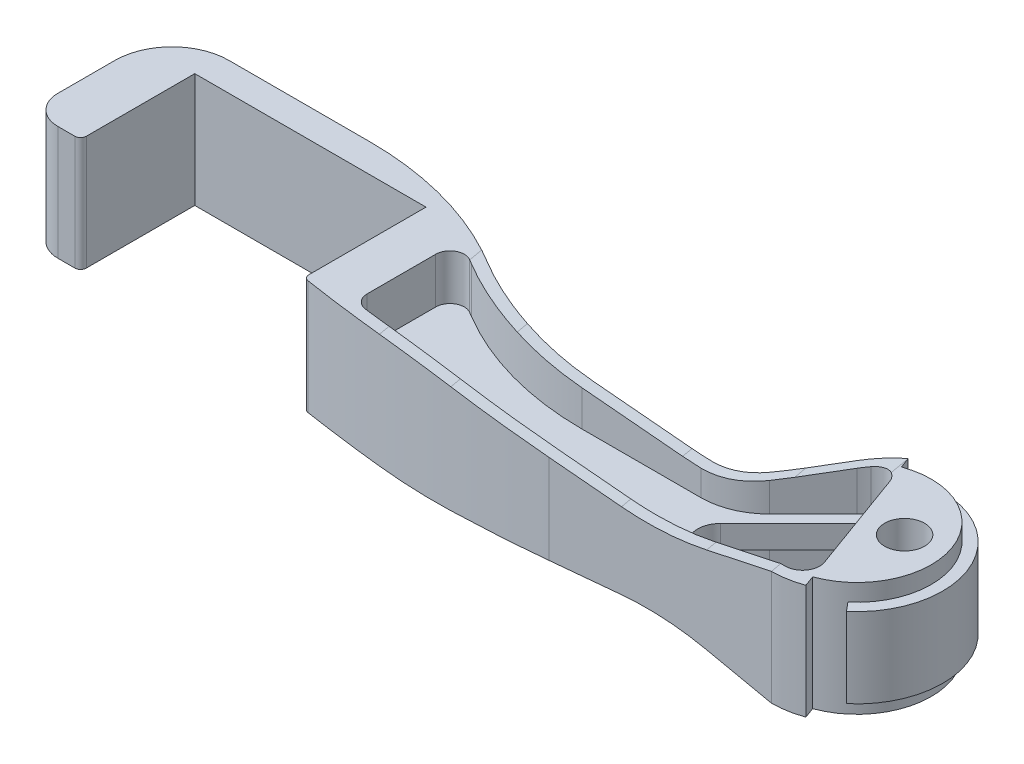
from build123d import *

# Parameters (mm, degrees)
CROQUIS1_R              = 3.5
SALIENTE_EXTRUIR1_DEPTH = 2
CROQUIS2_R              = 3.5
SALIENTE_EXTRUIR2_DEPTH = 10
SALIENTE_EXTRUIR3_DEPTH = 7
CORTAR_EXTRUIR1_DEPTH   = 83.665164829


with BuildPart() as part:
    # Croquis1 → Saliente-Extruir1 (new, symmetric)
    with BuildSketch(Plane(origin=(0, 0, 0), x_dir=(1, 0, 0), z_dir=(0, 1, 0))):
        with BuildLine():
            Line((-65, 15), (-40.296472568, 15))
            ThreePointArc((-40.296472568, 15), (-25.597104262, 12.999326141), (-11.967141117, 7.142857143))
            ThreePointArc((-11.967141117, 7.142857143), (0.423734469, 1.818794417), (13.786796564, 0))
            Line((13.786796564, 0), (34.644660941, 0))
            ThreePointArc((34.644660941, 0), (38.471495264, 0.761204675), (41.715728753, 2.928932188))
            Line((41.715728753, 2.928932188), (49.393398282, 10.606601718))
            ThreePointArc((49.393398282, 10.606601718), (51.940505875, 12.650871687), (54.86969785, 14.095389312))
            Line((54.86969785, 14.095389312), (55.553738137, 12.21600407))
            ThreePointArc((55.553738137, 12.21600407), (57.74257369, 12.802500789), (60, 13))
            Line((60, 13), (60, 15))
            ThreePointArc((60, 15), (74.095389312, 5.13030215), (69.641814145, -11.490666647))
            Line((69.641814145, -11.490666647), (68.356238926, -9.958577761))
            ThreePointArc((68.356238926, -9.958577761), (66.5, -11.258330249), (64.446261863, -12.21600407))
            Line((64.446261863, -12.21600407), (65.13030215, -14.095389312))
            ThreePointArc((65.13030215, -14.095389312), (62.604722665, -14.772116295), (60, -15))
            Line((60, -15), (21, -15))
            ThreePointArc((21, -15), (-1.892838305, -14.125254625), (-24.652173913, -11.506119696))
            ThreePointArc((-24.652173913, -11.506119696), (-25.259003924, -11.168852013), (-25.5, -10.517765963))
            Line((-25.5, -10.517765963), (-25.5, 10))
            Line((-25.5, 10), (-66, 10))
            Line((-66, 10), (-66, -9))
            ThreePointArc((-66, -9), (-66.292893219, -9.707106781), (-67, -10))
            Line((-67, -10), (-70, -10))
            ThreePointArc((-70, -10), (-73.535533906, -8.535533906), (-75, -5))
            Line((-75, -5), (-75, 5))
            ThreePointArc((-75, 5), (-72.071067812, 12.071067812), (-65, 15))
        make_face()
        with Locations(Location((66.108002035, 2.223130932, 0), (0, 0, 270))):
            Circle(CROQUIS1_R, mode=Mode.SUBTRACT)
        with BuildLine():
            Line((57.461693581, 6.97393957), (62.538306419, -6.97393957))
            ThreePointArc((62.538306419, -6.97393957), (62.17668469, -9.720729309), (59.719228557, -11))
            Line((59.719228557, -11), (43.108950141, -11))
            ThreePointArc((43.108950141, -11), (39.413432011, -8.530733729), (40.280523016, -4.171572875))
            Line((40.280523016, -4.171572875), (52.521295375, 8.069199484))
            ThreePointArc((52.521295375, 8.069199484), (55.29193456, 8.876767161), (57.461693581, 6.97393957))
        make_face(mode=Mode.SUBTRACT)
    extrude(amount=SALIENTE_EXTRUIR1_DEPTH, both=True)

    # Croquis2 → Saliente-Extruir2 (add, symmetric)
    with BuildSketch(Plane(origin=(0, 0, 0), x_dir=(1, 0, 0), z_dir=(0, 1, 0))):
        with BuildLine():
            Line((54.86969785, 14.095389312), (55.553738137, 12.21600407))
            ThreePointArc((55.553738137, 12.21600407), (72.21600407, 4.446261863), (64.446261863, -12.21600407))
            Line((64.446261863, -12.21600407), (65.13030215, -14.095389312))
            ThreePointArc((65.13030215, -14.095389312), (62.604722665, -14.772116295), (60, -15))
            Line((60, -15), (21, -15))
            ThreePointArc((21, -15), (-1.892838305, -14.125254625), (-24.652173913, -11.506119696))
            ThreePointArc((-24.652173913, -11.506119696), (-25.259003924, -11.168852013), (-25.5, -10.517765963))
            Line((-25.5, -10.517765963), (-25.5, 10))
            Line((-25.5, 10), (-66, 10))
            Line((-66, 10), (-66, -9))
            ThreePointArc((-66, -9), (-66.292893219, -9.707106781), (-67, -10))
            Line((-67, -10), (-70, -10))
            ThreePointArc((-70, -10), (-73.535533906, -8.535533906), (-75, -5))
            Line((-75, -5), (-75, 5))
            ThreePointArc((-75, 5), (-72.071067812, 12.071067812), (-65, 15))
            Line((-65, 15), (-40.296472568, 15))
            ThreePointArc((-40.296472568, 15), (-25.597104262, 12.999326141), (-11.967141117, 7.142857143))
            ThreePointArc((-11.967141117, 7.142857143), (0.423734469, 1.818794417), (13.786796564, 0))
            Line((13.786796564, 0), (34.644660941, 0))
            ThreePointArc((34.644660941, 0), (38.471495264, 0.761204675), (41.715728753, 2.928932188))
            Line((41.715728753, 2.928932188), (49.393398282, 10.606601718))
            ThreePointArc((49.393398282, 10.606601718), (51.940505875, 12.650871687), (54.86969785, 14.095389312))
        make_face()
        with Locations(Location((66.108002035, 2.223130932, 0), (0, 0, 270))):
            Circle(CROQUIS2_R, mode=Mode.SUBTRACT)
        with BuildLine():
            Line((13.786796564, -2), (34.644660941, -2))
            ThreePointArc((34.644660941, -2), (39.236862129, -1.08655439), (43.129942315, 1.514718626))
            Line((43.129942315, 1.514718626), (50.807611845, 9.192388155))
            ThreePointArc((50.807611845, 9.192388155), (51.432121169, 9.777088132), (52.093735288, 10.319446608))
            ThreePointArc((52.093735288, 10.319446608), (54.758810503, 10.817874623), (56.737335776, 8.964096282))
            Line((56.737335776, 8.964096282), (63.262664224, -8.964096282))
            ThreePointArc((63.262664224, -8.964096282), (62.938611682, -11.65594441), (60.57666227, -12.987203726))
            ThreePointArc((60.57666227, -12.987203726), (60.288402114, -12.996800538), (60, -13))
            Line((60, -13), (21, -13))
            ThreePointArc((21, -13), (2.813818289, -12.444554152), (-15.304568528, -10.780287213))
            ThreePointArc((-15.304568528, -10.780287213), (-16.872354309, -9.955498637), (-17.5, -8.298908965))
            Line((-17.5, -8.298908965), (-17.5, 3.707419))
            ThreePointArc((-17.5, 3.707419), (-16.248849159, 5.87314654), (-13.747699378, 5.871152614))
            ThreePointArc((-13.747699378, 5.871152614), (-13.371589613, 5.651403898), (-12.997298625, 5.428571429))
            ThreePointArc((-12.997298625, 5.428571429), (-0.110788015, -0.108453806), (13.786796564, -2))
        make_face(mode=Mode.SUBTRACT)
    extrude(amount=SALIENTE_EXTRUIR2_DEPTH, both=True)

    # Croquis3 → Saliente-Extruir3 (add, symmetric)
    with BuildSketch(Plane(origin=(0, 0, 0), x_dir=(1, 0, 0), z_dir=(0, 1, 0))):
        with BuildLine():
            Line((69.641814145, -11.490666647), (68.356238926, -9.958577761))
            ThreePointArc((68.356238926, -9.958577761), (72.21600407, 4.446261863), (60, 13))
            Line((60, 13), (60, 15))
            ThreePointArc((60, 15), (74.095389312, 5.13030215), (69.641814145, -11.490666647))
        make_face()
    extrude(amount=SALIENTE_EXTRUIR3_DEPTH, both=True)

    # Croquis4 → Cortar-Extruir1 (cut, through all, along a direction that is not the sketch's normal)
    with BuildSketch(Plane.XY.offset(15)):
        with BuildLine():
            Line((60, 10), (-10, 10))
            ThreePointArc((-10, 10), (-3.285105416, 9.849625261), (3.416325828, 9.398802543))
            Line((3.416325828, 9.398802543), (33.740168262, 6.675657889))
            ThreePointArc((33.740168262, 6.675657889), (41.229778106, 6.566394932), (48.651667745, 7.577210532))
            Line((48.651667745, 7.577210532), (60, 10))
        make_face()
        with BuildLine():
            Line((60, -10), (-10, -10))
            ThreePointArc((-10, -10), (-3.285105416, -9.849625261), (3.416325828, -9.398802543))
            Line((3.416325828, -9.398802543), (33.740168262, -6.675657889))
            ThreePointArc((33.740168262, -6.675657889), (41.229778106, -6.566394932), (48.651667745, -7.577210532))
            Line((48.651667745, -7.577210532), (60, -10))
        make_face()
    extrude(amount=-CORTAR_EXTRUIR1_DEPTH, dir=(0.1736481776669275, 0, 0.9848077530122086), mode=Mode.SUBTRACT)


solid = part.part
